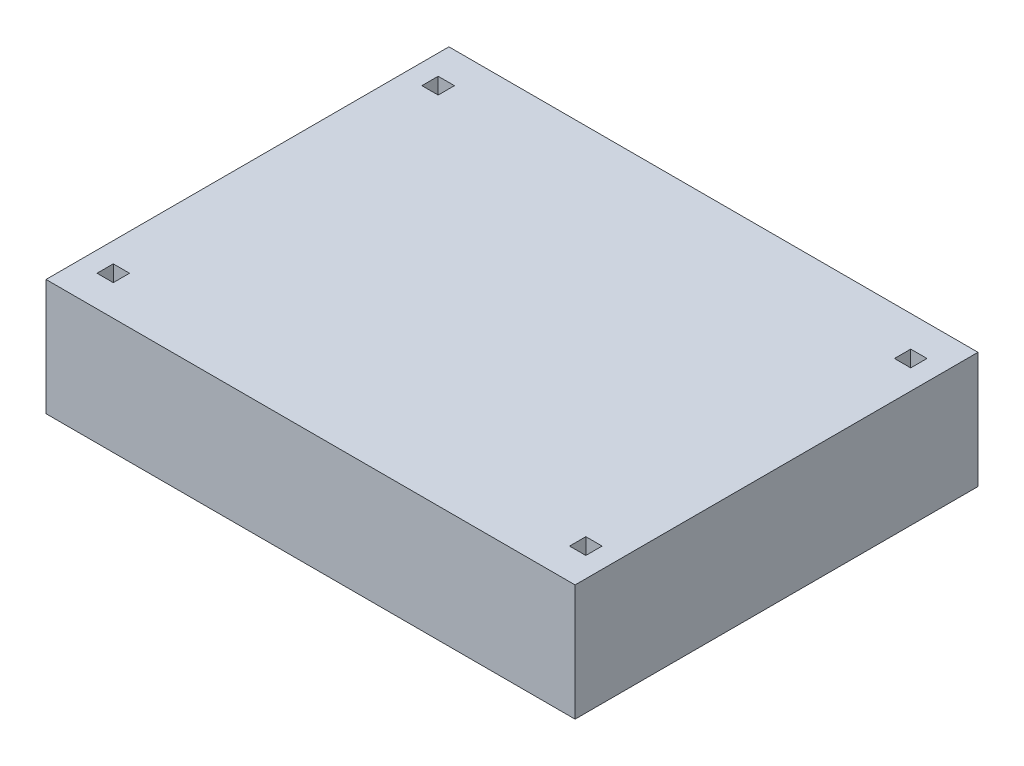
from build123d import *

# Parameters (mm, degrees)
SKETCH1_W             = 45.5
SKETCH1_H             = 34.65
BREADBOARD_BASE_DEPTH = 10
SKETCH2_W             = 1.4
SKETCH2_H             = 1.4
HOLES_FOR_PINS_DEPTH  = 6.5


with BuildPart() as part:
    # Sketch1 → Breadboard Base (new body)
    with BuildSketch(Plane(origin=(0, 0, 0), x_dir=(1, 0, 0), z_dir=(0, 1, 0))):
        Rectangle(SKETCH1_W, SKETCH1_H)
    extrude(amount=BREADBOARD_BASE_DEPTH)

    # Sketch2 → Holes for Pins (cut)
    with BuildSketch(Plane(origin=(0, 10, 0), x_dir=(1, 0, 0), z_dir=(0, 1, 0))):
        with Locations((-20.32, 13.97)):
            Rectangle(SKETCH2_W, SKETCH2_H)
        with Locations((20.32, 13.97)):
            Rectangle(SKETCH2_W, SKETCH2_H)
        with Locations((-20.32, -13.97)):
            Rectangle(SKETCH2_W, SKETCH2_H)
        with Locations((20.32, -13.97)):
            Rectangle(SKETCH2_W, SKETCH2_H)
    extrude(amount=-HOLES_FOR_PINS_DEPTH, mode=Mode.SUBTRACT)


solid = part.part
